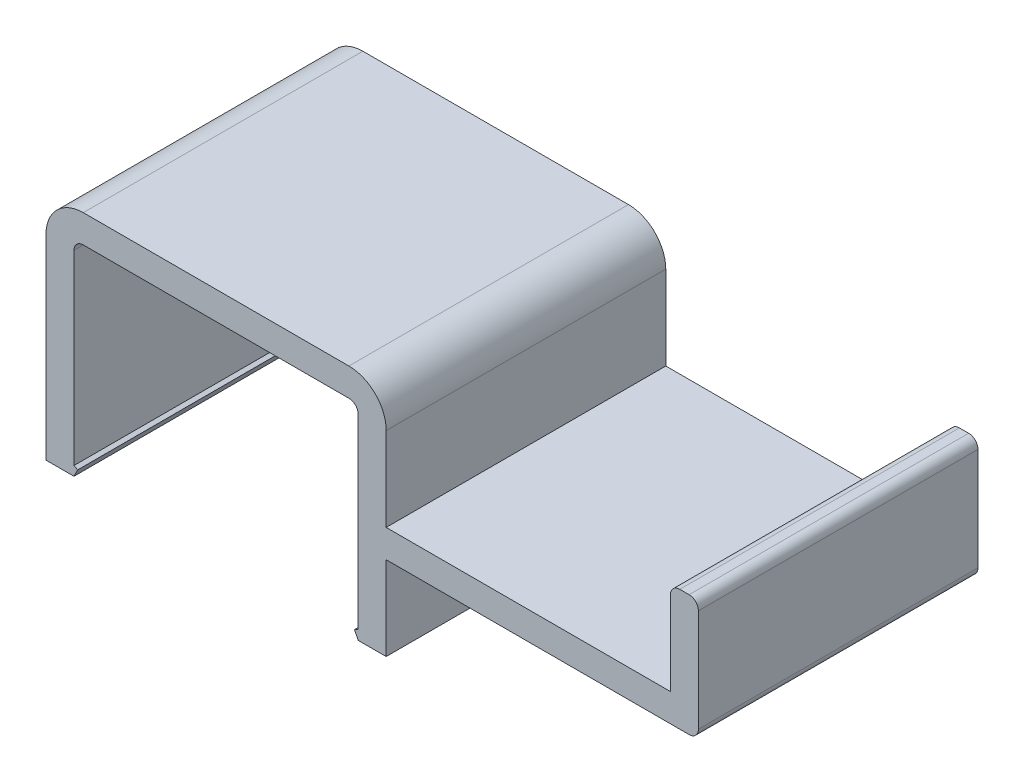
from build123d import *

# Parameters (mm, degrees)
EXTRUDE_THIN1_DEPTH = 30
BOSS_EXTRUDE1_DEPTH = 30
SKETCH3_W           = 30
SKETCH3_H           = 3
EXTRUDE_THIN2_DEPTH = 30
BOSS_EXTRUDE2_DEPTH = 30


with BuildPart() as part:
    # Sketch1 → Extrude-Thin1 (new body)
    with BuildSketch(Plane.XY):
        with BuildLine():
            Line((-15, -12.5), (-15, 7.5))
            ThreePointArc((-15, 7.5), (-14.707106781, 8.207106781), (-14, 8.5))
            Line((-14, 8.5), (14.5, 8.5))
            ThreePointArc((14.5, 8.5), (15.207106781, 8.207106781), (15.5, 7.5))
            Line((15.5, 7.5), (15.5, -12.5))
            Line((15.5, -12.5), (18.5, -12.5))
            Line((18.5, -12.5), (18.5, 7.5))
            ThreePointArc((18.5, 7.5), (17.328427125, 10.328427125), (14.5, 11.5))
            Line((14.5, 11.5), (-14, 11.5))
            ThreePointArc((-14, 11.5), (-16.828427125, 10.328427125), (-18, 7.5))
            Line((-18, 7.5), (-18, -12.5))
            Line((-18, -12.5), (-15, -12.5))
        make_face()
    extrude(amount=EXTRUDE_THIN1_DEPTH)

    # Sketch2 → Boss-Extrude1 (add)
    with BuildSketch(Plane.XY.offset(30)):
        Polygon((-15, -13.5), (-18, -13.5), (-18, -12.5), (-15, -12.5), (-14.6, -12.7), align=None)
        Polygon((15.5, -12.5), (15.1, -12.7), (15.5, -13.5), (18.5, -13.5), (18.5, -12.5), align=None)
    extrude(amount=-BOSS_EXTRUDE1_DEPTH)

    # Sketch3 → Extrude-Thin2 (add)
    with BuildSketch(Plane(origin=(18.5, 0, 0), x_dir=(0, 0, -1), z_dir=(1, 0, 0))):
        with Locations((-15, -3)):
            Rectangle(SKETCH3_W, SKETCH3_H)
    extrude(amount=EXTRUDE_THIN2_DEPTH)

    # Sketch4 → Boss-Extrude2 (add)
    with BuildSketch(Plane.XY.offset(30)):
        with BuildLine():
            Line((48.5, -1.5), (49, -1.5))
            Line((49, -1.5), (49, 7.5))
            ThreePointArc((49, 7.5), (49.292893219, 8.207106781), (50, 8.5))
            Line((50, 8.5), (51, 8.5))
            ThreePointArc((51, 8.5), (51.707106781, 8.207106781), (52, 7.5))
            Line((52, 7.5), (52, -3.5))
            ThreePointArc((52, -3.5), (51.707106781, -4.207106781), (51, -4.5))
            Line((51, -4.5), (48.5, -4.5))
            Line((48.5, -4.5), (48.5, -1.5))
        make_face()
    extrude(amount=-BOSS_EXTRUDE2_DEPTH)


solid = part.part
